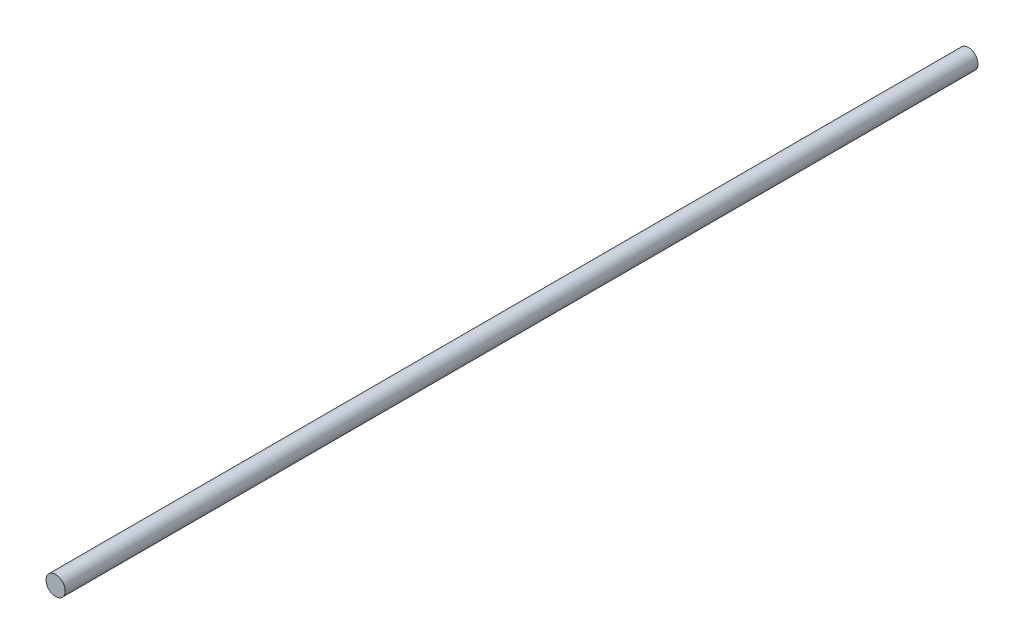
from build123d import *

# Parameters (mm, degrees)
SKETCH1_R           = 1
BOSS_EXTRUDE1_DEPTH = 95


with BuildPart() as part:
    # Sketch1 → Boss-Extrude1 (new body)
    with BuildSketch(Plane.XY):
        with Locations((20, 0)):
            Circle(SKETCH1_R)
    extrude(amount=-BOSS_EXTRUDE1_DEPTH)


solid = part.part
